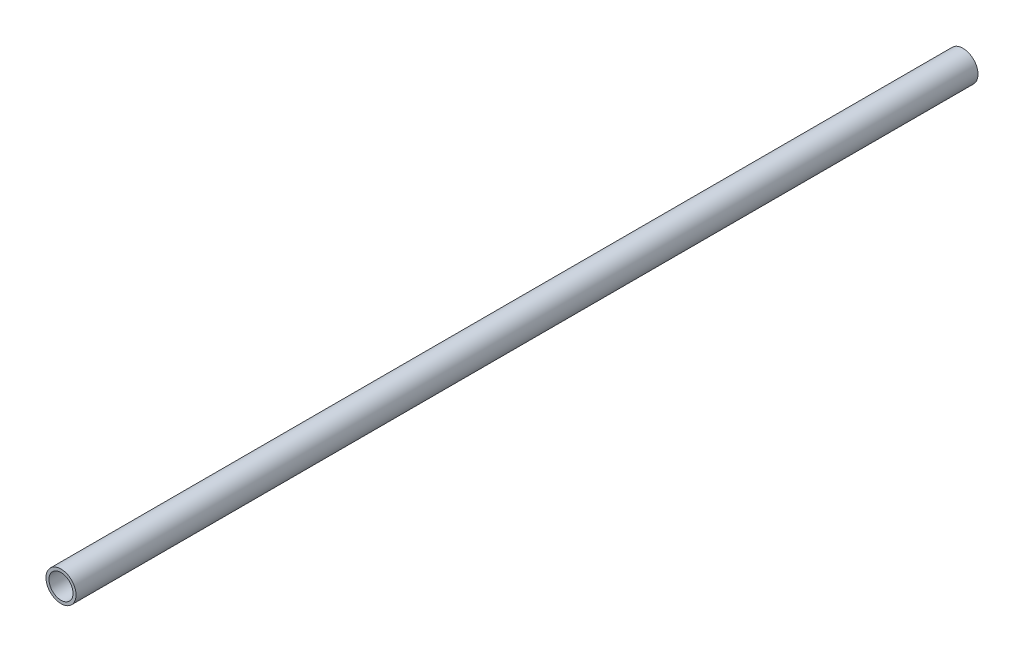
from build123d import *

# Parameters (mm, degrees)
SZKIC1_R                    = 5
SZKIC1_R_2                  = 4
DODANIE_WYCI_GNI_CIE1_DEPTH = 300


with BuildPart() as part:
    # Szkic1 → Dodanie-wyciągnięcie1 (new body)
    with BuildSketch(Plane.XY):
        Circle(SZKIC1_R)
        Circle(SZKIC1_R_2, mode=Mode.SUBTRACT)
    extrude(amount=DODANIE_WYCI_GNI_CIE1_DEPTH)


solid = part.part
